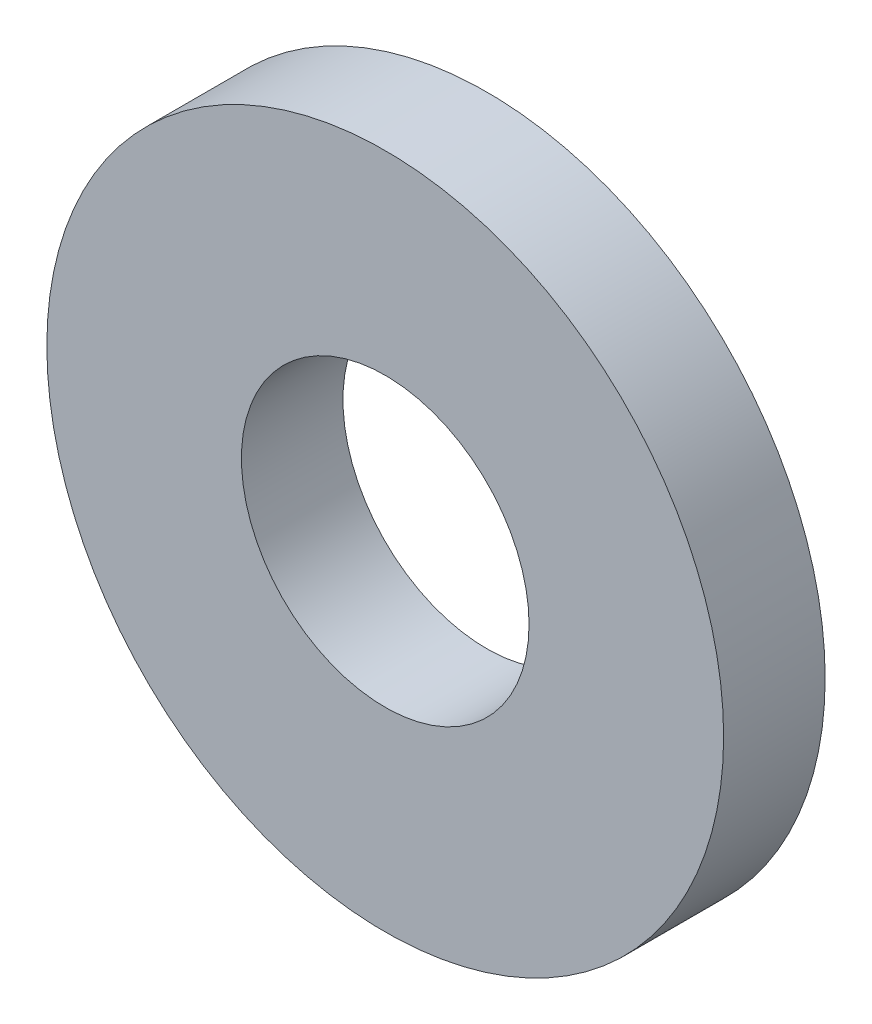
from build123d import *

# Parameters (mm, degrees)
SKETCH1_R           = 20
SKETCH1_R_2         = 8.5
BOSS_EXTRUDE1_DEPTH = 6


with BuildPart() as part:
    # Sketch1 → Boss-Extrude1 (new body)
    with BuildSketch(Plane.XY):
        with Locations((350, 87)):
            Circle(SKETCH1_R)
        with Locations((350, 87)):
            Circle(SKETCH1_R_2, mode=Mode.SUBTRACT)
    extrude(amount=BOSS_EXTRUDE1_DEPTH)


solid = part.part
